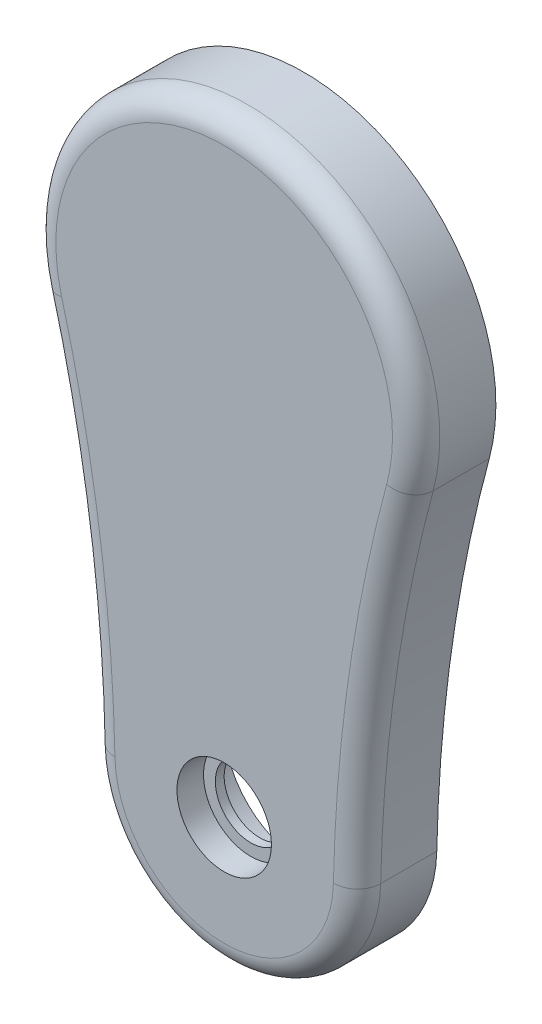
from build123d import *

# Parameters (mm, degrees)
EXTRUDE_2_DEPTH     = 13.5
SKETCH_3_R          = 6
CUT_EXTRUDE_1_DEPTH = 162.383859168
CUT_EXTRUDE_START   = 9
SKETCH_3_3_R        = 8
CUT_EXTRUDE_2_DEPTH = 153.383859168
SKETCH_3_4_R        = 13.5
CUT_EXTRUDE_3_DEPTH = 7.5
FILLET_1_R          = 4
SKETCH_3_5_R        = 21
CUT_EXTRUDE_5_DEPTH = 10.5
SKETCH_3_6_R        = 23.5
CUT_EXTRUDE_7_DEPTH = 7


with BuildPart() as part:
    # Эскиз2 → Бобышка-Вытянуть2 (new body)
    with BuildSketch(Plane.XY):
        with BuildLine():
            ThreePointArc((-31.381638839, 116.547619048), (-25.062561701, 85.800741423), (-22.494803062, 54.516434893))
            ThreePointArc((-22.494803062, 54.516434893), (0, 32.5), (22.494803062, 54.516434893))
            ThreePointArc((22.494803062, 54.516434893), (25.062561701, 85.800741423), (31.381638839, 116.547619048))
            ThreePointArc((31.381638839, 116.547619048), (0, 157.5), (-31.381638839, 116.547619048))
        make_face()
    extrude(amount=EXTRUDE_2_DEPTH)

    # Эскиз3 → Вырез-Вытянуть1 (cut, through all)
    with BuildSketch(Plane.XY):
        with Locations((0, 55)):
            Circle(SKETCH_3_R)
    extrude(amount=CUT_EXTRUDE_1_DEPTH, mode=Mode.SUBTRACT)

    # Эскиз3<3> → Вырез-Вытянуть2 (cut, through all)
    with BuildSketch(Plane.XY.offset(CUT_EXTRUDE_START)):
        with Locations((0, 55)):
            Circle(SKETCH_3_3_R)
    extrude(amount=CUT_EXTRUDE_2_DEPTH, mode=Mode.SUBTRACT)

    # Эскиз3<4> → Вырез-Вытянуть3 (cut)
    with BuildSketch(Plane.XY):
        with Locations((0, 55)):
            Circle(SKETCH_3_4_R)
    extrude(amount=CUT_EXTRUDE_3_DEPTH, mode=Mode.SUBTRACT)

    # Скругление1
    fillet_1_edges = [part.edges().sort_by_distance(p)[0] for p in [
        (25.062561701, 85.800741423, 13.5),
        (0, 157.5, 13.5),
        (-25.062561701, 85.800741423, 13.5),
        (0, 32.5, 13.5),
    ]]
    fillet(fillet_1_edges, radius=FILLET_1_R)

    # Эскиз3<5> → Вырез-Вытянуть5 (cut)
    with BuildSketch(Plane.XY):
        with Locations(Location((0, 125, 0), (0, 0, 180))):
            Circle(SKETCH_3_5_R)
    extrude(amount=CUT_EXTRUDE_5_DEPTH, mode=Mode.SUBTRACT)

    # Эскиз3<6> → Вырез-Вытянуть7 (cut)
    with BuildSketch(Plane.XY):
        with Locations((0, 125)):
            Circle(SKETCH_3_6_R)
    extrude(amount=CUT_EXTRUDE_7_DEPTH, mode=Mode.SUBTRACT)


solid = part.part
